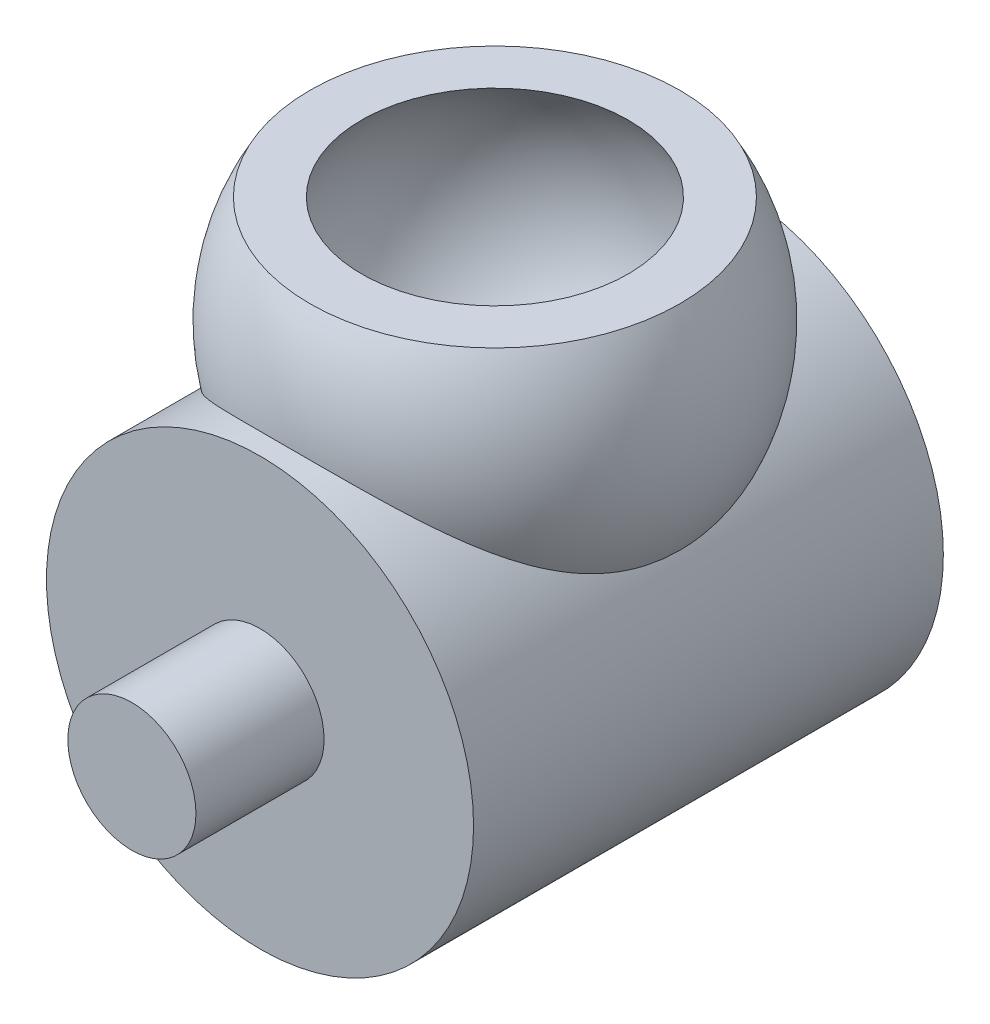
from build123d import *

# Parameters (mm, degrees)
SKETCH1_R           = 10
BOSS_EXTRUDE1_DEPTH = 22
SKETCH2_R           = 3
BOSS_EXTRUDE2_DEPTH = 6


with BuildPart() as part:
    # Sketch1 → Boss-Extrude1 (new body)
    with BuildSketch(Plane.XY):
        Circle(SKETCH1_R)
    extrude(amount=BOSS_EXTRUDE1_DEPTH)

    # Sketch2 → Boss-Extrude2 (add)
    with BuildSketch(Plane.XY.offset(22)):
        Circle(SKETCH2_R)
    extrude(amount=BOSS_EXTRUDE2_DEPTH)

    # Sketch6 → Cut-Revolve3 (revolve, cut)
    with BuildSketch(Plane(origin=(0, 0, 0), x_dir=(0, 0, -1), z_dir=(1, 0, 0)), mode=Mode.PRIVATE) as cut_revolve3_sk:
        with BuildLine():
            Line((-11, 0), (-11, 10))
            Line((-11, 10), (-1, 10))
            ThreePointArc((-1, 10), (-3.928932188, 2.928932188), (-11, 0))
        make_face()
    revolve(cut_revolve3_sk.sketch.rotate(Axis((0, 0, 11), (0, 1, 0)), 180), axis=Axis((0, 0, 11), (0, 1, 0)), mode=Mode.SUBTRACT)

    # Sketch7 → Revolve1 (revolve)
    with BuildSketch(Plane(origin=(0, 0, 0), x_dir=(0, 0, -1), z_dir=(1, 0, 0)), mode=Mode.PRIVATE) as revolve1_sk:
        with BuildLine():
            Line((-4.755002002, 15), (-2.339745962, 15))
            ThreePointArc((-2.339745962, 15), (-2.339745962, 5), (-11, 0))
            Line((-11, 0), (-11, 2))
            ThreePointArc((-11, 2), (-3.788897449, 6.535898385), (-4.755002002, 15))
        make_face()
    revolve(revolve1_sk.sketch.rotate(Axis((0, 0, 11), (0, 1, 0)), 270), axis=Axis((0, 0, 11), (0, 1, 0)))


solid = part.part
